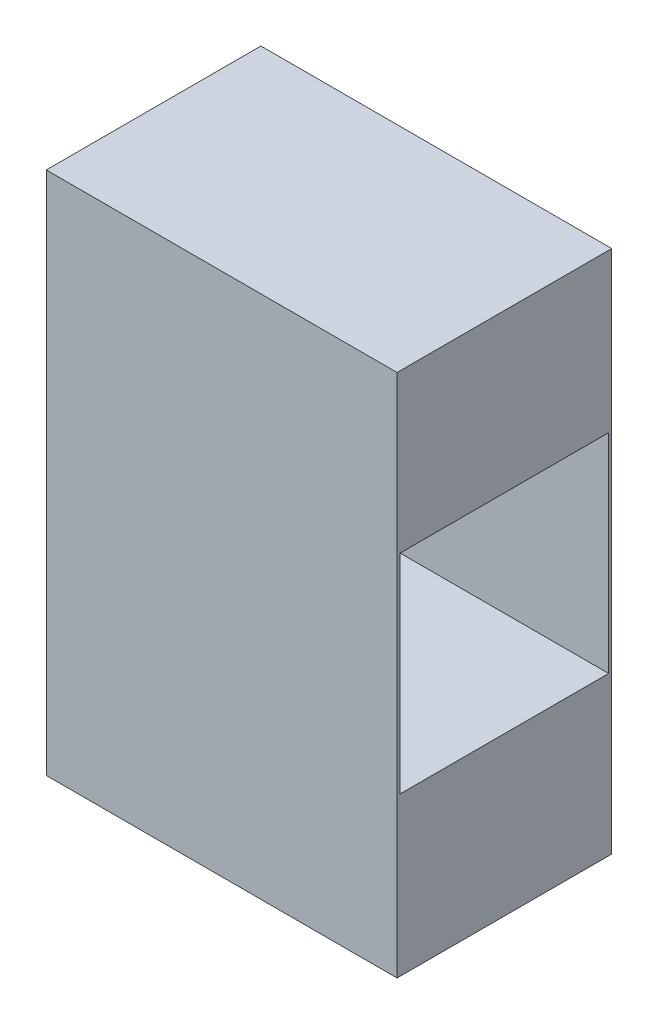
from build123d import *

# Parameters (mm, degrees)
SKETCH1_W           = 29.0576
SKETCH1_H           = 17.78
BOSS_EXTRUDE1_DEPTH = 43.434
SKETCH2_W           = 17.272
SKETCH2_H           = 17.272
CUT_EXTRUDE1_DEPTH  = 25.4


with BuildPart() as part:
    # Sketch1 → Boss-Extrude1 (new body)
    with BuildSketch(Plane(origin=(0, 0, 0), x_dir=(1, 0, 0), z_dir=(0, 1, 0))):
        with Locations((14.5288, 8.89)):
            Rectangle(SKETCH1_W, SKETCH1_H)
    extrude(amount=BOSS_EXTRUDE1_DEPTH)

    # Sketch2 → Cut-Extrude1 (cut)
    with BuildSketch(Plane(origin=(29.0576, 0, 0), x_dir=(0, 0, -1), z_dir=(1, 0, 0))):
        with Locations((8.89, 21.717)):
            Rectangle(SKETCH2_W, SKETCH2_H)
    extrude(amount=-CUT_EXTRUDE1_DEPTH, mode=Mode.SUBTRACT)


solid = part.part
